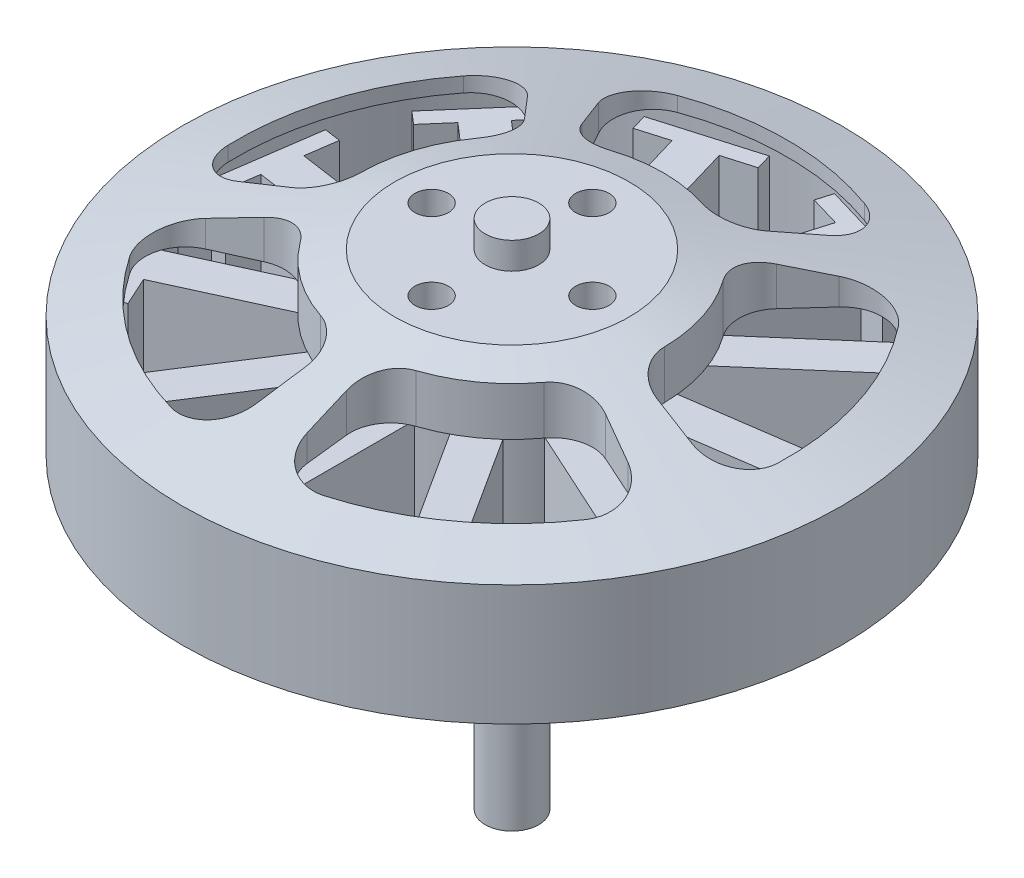
from build123d import *

# Parameters (mm, degrees)
CROQUIS1_R              = 24.6
SALIENTE_EXTRUIR1_DEPTH = 9
CROQUIS4_R              = 22.838904737
CORTAR_EXTRUIR1_DEPTH   = 9
CORTAR_EXTRUIR2_DEPTH   = 38.245268156
SALIENTE_EXTRUIR2_START = -6
CROQUIS3_R              = 2
SALIENTE_EXTRUIR2_DEPTH = 8
SALIENTE_EXTRUIR3_DEPTH = 8
CROQUIS7_R              = 7.5
SALIENTE_EXTRUIR4_DEPTH = 5
CROQUIS8_R              = 12.25
SALIENTE_EXTRUIR5_DEPTH = 1.2
SALIENTE_EXTRUIR6_START = 16
CROQUIS9_R              = 2
SALIENTE_EXTRUIR6_DEPTH = 16
SALIENTE_EXTRUIR7_DEPTH = 0.8
CROQUIS11_R             = 1.25
CORTAR_EXTRUIR3_DEPTH   = 3
CROQUIS12_R             = 1.348388042
CORTAR_EXTRUIR4_DEPTH   = 6
SALIENTE_EXTRUIR8_START = 1
SALIENTE_EXTRUIR8_DEPTH = 2


with BuildPart() as part:
    # Croquis1 → Saliente-Extruir1 (new body)
    with BuildSketch(Plane(origin=(0, 0, 0), x_dir=(1, 0, 0), z_dir=(0, 1, 0))):
        with Locations(Location((0, 0, 0), (0, 0, 270))):
            Circle(CROQUIS1_R)
    extrude(amount=SALIENTE_EXTRUIR1_DEPTH)

    # Croquis2 → Revolución1 (revolve)
    with BuildSketch(Plane.XY, mode=Mode.PRIVATE) as revoluci_n1_sk:
        Polygon((-24.6, 9), (-8.75, 13.3), (0, 13.3), (0, 9), align=None)
    revolve(revoluci_n1_sk.sketch.rotate(Axis((0, 13.3, 0), (0, -1, 0)), 270), axis=Axis((0, 13.3, 0), (0, -1, 0)))

    # Croquis4 → Cortar-Extruir1 (cut)
    with BuildSketch(Plane.XZ):
        with Locations(Location((0, 0, 0), (0, 0, 270))):
            Circle(CROQUIS4_R)
    extrude(amount=-CORTAR_EXTRUIR1_DEPTH, mode=Mode.SUBTRACT)

    # Croquis5 → Cortar-Extruir2 (cut, through all)
    with BuildSketch(Plane(origin=(0, 13.3, 0), x_dir=(1, 0, 0), z_dir=(0, 1, 0))):
        with BuildLine():
            Line((-8.570425655, 15.0190469), (-6.930143541, 12.144571933))
            ThreePointArc((-6.930143541, 12.144571933), (-5.416422682, 10.837196574), (-3.417344005, 10.7718849))
            ThreePointArc((-3.417344005, 10.7718849), (0, 11.300962098), (3.417344005, 10.7718849))
            ThreePointArc((3.417344005, 10.7718849), (5.416422682, 10.837196574), (6.930143541, 12.144571933))
            Line((6.930143541, 12.144571933), (8.570425655, 15.0190469))
            ThreePointArc((8.570425655, 15.0190469), (8.780099609, 17.542313757), (6.984398181, 19.327333417))
            ThreePointArc((6.984398181, 19.327333417), (0, 20.550611547), (-6.984398181, 19.327333417))
            ThreePointArc((-6.984398181, 19.327333417), (-8.780099609, 17.542313757), (-8.570425655, 15.0190469))
        make_face()
        with BuildLine():
            Line((11.635555246, 12.792099897), (9.408642147, 10.34383729))
            ThreePointArc((9.408642147, 10.34383729), (8.633019762, 8.500201999), (9.188653954, 6.57878278))
            ThreePointArc((9.188653954, 6.57878278), (10.747853644, 3.492189341), (11.3006887, 0.078608211))
            ThreePointArc((11.3006887, 0.078608211), (11.980553077, -1.802446174), (13.691706402, -2.838079057))
            Line((13.691706402, -2.838079057), (16.932369599, -3.509818435))
            ThreePointArc((16.932369599, -3.509818435), (19.396931801, -2.929497875), (20.539684122, -0.670082921))
            ThreePointArc((20.539684122, -0.670082921), (19.544793026, 6.350488213), (16.223088655, 12.615031884))
            ThreePointArc((16.223088655, 12.615031884), (13.970531818, 13.771244019), (11.635555246, 12.792099897))
        make_face()
        with BuildLine():
            Line((15.761594275, -7.113094375), (12.745004176, -5.751728914))
            ThreePointArc((12.745004176, -5.751728914), (10.751922321, -5.583782827), (9.096244459, -6.705973537))
            ThreePointArc((9.096244459, -6.705973537), (6.642538858, -9.14267039), (3.566865708, -10.723302354))
            ThreePointArc((3.566865708, -10.723302354), (1.987966324, -11.951169572), (1.53179638, -13.898601253))
            Line((1.53179638, -13.898601253), (1.894354267, -17.188233987))
            ThreePointArc((1.894354267, -17.188233987), (3.207863522, -19.352843014), (5.709824725, -19.741467437))
            ThreePointArc((5.709824725, -19.741467437), (12.079346393, -16.625793986), (17.010818372, -11.530814943))
            ThreePointArc((17.010818372, -11.530814943), (17.414363114, -9.031216887), (15.761594275, -7.113094375))
        make_face()
        with BuildLine():
            Line((-1.894354267, -17.188233987), (-1.53179638, -13.898601253))
            ThreePointArc((-1.53179638, -13.898601253), (-1.987966324, -11.951169572), (-3.566865708, -10.723302354))
            ThreePointArc((-3.566865708, -10.723302354), (-6.642538858, -9.14267039), (-9.096244459, -6.705973537))
            ThreePointArc((-9.096244459, -6.705973537), (-10.751922321, -5.583782827), (-12.745004176, -5.751728914))
            Line((-12.745004176, -5.751728914), (-15.761594275, -7.113094375))
            ThreePointArc((-15.761594275, -7.113094375), (-17.414363114, -9.031216887), (-17.010818372, -11.530814943))
            ThreePointArc((-17.010818372, -11.530814943), (-12.079346393, -16.625793986), (-5.709824725, -19.741467437))
            ThreePointArc((-5.709824725, -19.741467437), (-3.207863522, -19.352843014), (-1.894354267, -17.188233987))
        make_face()
        with BuildLine():
            Line((-16.932369599, -3.509818435), (-13.691706402, -2.838079057))
            ThreePointArc((-13.691706402, -2.838079057), (-11.980553077, -1.802446174), (-11.3006887, 0.078608211))
            ThreePointArc((-11.3006887, 0.078608211), (-10.747853644, 3.492189341), (-9.188653954, 6.57878278))
            ThreePointArc((-9.188653954, 6.57878278), (-8.633019762, 8.500201999), (-9.408642147, 10.34383729))
            Line((-9.408642147, 10.34383729), (-11.635555246, 12.792099897))
            ThreePointArc((-11.635555246, 12.792099897), (-13.970531818, 13.771244019), (-16.223088655, 12.615031884))
            ThreePointArc((-16.223088655, 12.615031884), (-19.544793026, 6.350488213), (-20.539684122, -0.670082921))
            ThreePointArc((-20.539684122, -0.670082921), (-19.396931801, -2.929497875), (-16.932369599, -3.509818435))
        make_face()
    extrude(amount=-CORTAR_EXTRUIR2_DEPTH, mode=Mode.SUBTRACT)

    # Croquis3 → Saliente-Extruir2 (add)
    with BuildSketch(Plane(origin=(0, 13.3, 0), x_dir=(1, 0, 0), z_dir=(0, 1, 0)).offset(SALIENTE_EXTRUIR2_START)):
        with Locations(Location((0, 0, 0), (0, 0, 90))):
            Circle(CROQUIS3_R)
    extrude(amount=SALIENTE_EXTRUIR2_DEPTH)

    # Croquis6 → Saliente-Extruir3 (add)
    with BuildSketch(Plane.XZ.offset(-7.3)):
        with BuildLine():
            Line((-1.41776314, 20.230911324), (-1.41776314, 8.691927398))
            ThreePointArc((-1.41776314, 8.691927398), (-2.48116113, 8.450058797), (-3.506512483, 8.078615254))
            Line((-3.506512483, 8.078615254), (-9.744958186, 17.785826247))
            Line((-9.744958186, 17.785826247), (-7.771261406, 19.054244148))
            Line((-7.771261406, 19.054244148), (-8.431305766, 20.08129322))
            Line((-8.431305766, 20.08129322), (-14.764095827, 16.011456172))
            Line((-14.764095827, 16.011456172), (-14.104051466, 14.984407099))
            Line((-14.104051466, 14.984407099), (-12.130354686, 16.252825001))
            Line((-12.130354686, 16.252825001), (-5.891908984, 6.545614008))
            ThreePointArc((-5.891908984, 6.545614008), (-6.655732261, 5.767224834), (-7.317495169, 4.900399847))
            Line((-7.317495169, 4.900399847), (-17.813724142, 9.693867005))
            Line((-17.813724142, 9.693867005), (-16.839103244, 11.827989086))
            Line((-16.839103244, 11.827989086), (-17.949632544, 12.335150824))
            Line((-17.949632544, 12.335150824), (-21.076794527, 5.487621234))
            Line((-21.076794527, 5.487621234), (-19.966265227, 4.980459496))
            Line((-19.966265227, 4.980459496), (-18.991644329, 7.114581576))
            Line((-18.991644329, 7.114581576), (-8.495415356, 2.321114419))
            ThreePointArc((-8.495415356, 2.321114419), (-8.717155427, 1.253337736), (-8.805224842, 0.166342114))
            Line((-8.805224842, 0.166342114), (-20.226758549, -1.475826517))
            Line((-20.226758549, -1.475826517), (-20.560648782, 0.846431062))
            Line((-20.560648782, 0.846431062), (-21.769077816, 0.672685197))
            Line((-21.769077816, 0.672685197), (-20.697759886, -6.778494673))
            Line((-20.697759886, -6.778494673), (-19.489330852, -6.604748808))
            Line((-19.489330852, -6.604748808), (-19.823221085, -4.282491229))
            Line((-19.823221085, -4.282491229), (-8.401687378, -2.640322598))
            ThreePointArc((-8.401687378, -2.640322598), (-8.010943337, -3.658475238), (-7.497357842, -4.620528066))
            Line((-7.497357842, -4.620528066), (-16.217940032, -12.176955548))
            Line((-16.217940032, -12.176955548), (-17.754333606, -10.403862844))
            Line((-17.754333606, -10.403862844), (-18.676994694, -11.203353227))
            Line((-18.676994694, -11.203353227), (-13.747332725, -16.892486415))
            Line((-13.747332725, -16.892486415), (-12.824671637, -16.092996032))
            Line((-12.824671637, -16.092996032), (-14.361065211, -14.319903328))
            Line((-14.361065211, -14.319903328), (-5.640483021, -6.763475845))
            ThreePointArc((-5.640483021, -6.763475845), (-4.761313341, -7.408748173), (-3.809132701, -7.940413231))
            Line((-3.809132701, -7.940413231), (-7.060040146, -19.011987231))
            Line((-7.060040146, -19.011987231), (-9.311142957, -18.351003807))
            Line((-9.311142957, -18.351003807), (-9.655097722, -19.522406161))
            Line((-9.655097722, -19.522406161), (-2.432224557, -21.643233077))
            Line((-2.432224557, -21.643233077), (-2.088269792, -20.471830723))
            Line((-2.088269792, -20.471830723), (-4.339372603, -19.8108473))
            Line((-4.339372603, -19.8108473), (-1.088465159, -8.7392733))
            ThreePointArc((-1.088465159, -8.7392733), (0, -8.806795911), (1.088465159, -8.7392733))
            Line((1.088465159, -8.7392733), (4.339372603, -19.8108473))
            Line((4.339372603, -19.8108473), (2.088269792, -20.471830723))
            Line((2.088269792, -20.471830723), (2.432224557, -21.643233077))
            Line((2.432224557, -21.643233077), (9.655097722, -19.522406161))
            Line((9.655097722, -19.522406161), (9.311142957, -18.351003807))
            Line((9.311142957, -18.351003807), (7.060040146, -19.011987231))
            Line((7.060040146, -19.011987231), (3.809132701, -7.940413231))
            ThreePointArc((3.809132701, -7.940413231), (4.761313341, -7.408748173), (5.640483021, -6.763475845))
            Line((5.640483021, -6.763475845), (14.361065211, -14.319903328))
            Line((14.361065211, -14.319903328), (12.824671637, -16.092996032))
            Line((12.824671637, -16.092996032), (13.747332725, -16.892486415))
            Line((13.747332725, -16.892486415), (18.676994694, -11.203353227))
            Line((18.676994694, -11.203353227), (17.754333606, -10.403862844))
            Line((17.754333606, -10.403862844), (16.217940032, -12.176955548))
            Line((16.217940032, -12.176955548), (7.497357842, -4.620528066))
            ThreePointArc((7.497357842, -4.620528066), (8.010943337, -3.658475238), (8.401687378, -2.640322598))
            Line((8.401687378, -2.640322598), (19.823221085, -4.282491229))
            Line((19.823221085, -4.282491229), (19.489330852, -6.604748808))
            Line((19.489330852, -6.604748808), (20.697759886, -6.778494673))
            Line((20.697759886, -6.778494673), (21.769077816, 0.672685197))
            Line((21.769077816, 0.672685197), (20.560648782, 0.846431062))
            Line((20.560648782, 0.846431062), (20.226758549, -1.475826517))
            Line((20.226758549, -1.475826517), (8.805224842, 0.166342114))
            ThreePointArc((8.805224842, 0.166342114), (8.717155427, 1.253337736), (8.495415356, 2.321114419))
            Line((8.495415356, 2.321114419), (18.991644329, 7.114581576))
            Line((18.991644329, 7.114581576), (19.966265227, 4.980459496))
            Line((19.966265227, 4.980459496), (21.076794527, 5.487621234))
            Line((21.076794527, 5.487621234), (17.949632544, 12.335150824))
            Line((17.949632544, 12.335150824), (16.839103244, 11.827989086))
            Line((16.839103244, 11.827989086), (17.813724142, 9.693867005))
            Line((17.813724142, 9.693867005), (7.317495169, 4.900399847))
            ThreePointArc((7.317495169, 4.900399847), (6.655732261, 5.767224834), (5.891908984, 6.545614008))
            Line((5.891908984, 6.545614008), (12.130354686, 16.252825001))
            Line((12.130354686, 16.252825001), (14.104051466, 14.984407099))
            Line((14.104051466, 14.984407099), (14.764095827, 16.011456172))
            Line((14.764095827, 16.011456172), (8.431305766, 20.08129322))
            Line((8.431305766, 20.08129322), (7.771261406, 19.054244148))
            Line((7.771261406, 19.054244148), (9.744958186, 17.785826247))
            Line((9.744958186, 17.785826247), (3.506512483, 8.078615254))
            ThreePointArc((3.506512483, 8.078615254), (2.48116113, 8.450058797), (1.41776314, 8.691927398))
            Line((1.41776314, 8.691927398), (1.41776314, 20.230911324))
            Line((1.41776314, 20.230911324), (3.76390102, 20.230911324))
            Line((3.76390102, 20.230911324), (3.76390102, 21.451766907))
            Line((3.76390102, 21.451766907), (-3.76390102, 21.451766907))
            Line((-3.76390102, 21.451766907), (-3.76390102, 20.230911324))
            Line((-3.76390102, 20.230911324), (-1.41776314, 20.230911324))
        make_face()
    extrude(amount=SALIENTE_EXTRUIR3_DEPTH)

    # Croquis7 → Saliente-Extruir4 (add)
    with BuildSketch(Plane.XZ.offset(0.7)):
        Circle(CROQUIS7_R)
    extrude(amount=SALIENTE_EXTRUIR4_DEPTH)

    # Croquis8 → Saliente-Extruir5 (add)
    with BuildSketch(Plane.XZ.offset(5.7)):
        Circle(CROQUIS8_R)
    extrude(amount=SALIENTE_EXTRUIR5_DEPTH)

    # Croquis9 → Saliente-Extruir6 (add)
    with BuildSketch(Plane.XZ.offset(6.9).offset(SALIENTE_EXTRUIR6_START)):
        Circle(CROQUIS9_R)
    extrude(amount=-SALIENTE_EXTRUIR6_DEPTH)

    # Croquis10 → Saliente-Extruir7 (add)
    with BuildSketch(Plane.XZ.offset(6.9)):
        with BuildLine():
            Line((-1.85, 4.270295341), (-1.85, 1.681517172))
            ThreePointArc((-1.85, 1.681517172), (0, -2.5), (1.85, 1.681517172))
            Line((1.85, 1.681517172), (1.85, 4.270295341))
            Line((1.85, 4.270295341), (-1.85, 4.270295341))
        make_face()
    extrude(amount=SALIENTE_EXTRUIR7_DEPTH)

    # Croquis11 → Cortar-Extruir3 (cut)
    with BuildSketch(Plane(origin=(0, 13.3, 0), x_dir=(1, 0, 0), z_dir=(0, 1, 0))):
        with Locations(Location((0, -6, 0), (0, 0, 180))):
            Circle(CROQUIS11_R)
        with Locations(Location((6, 0, 0), (0, 0, 180))):
            Circle(CROQUIS11_R)
        with Locations(Location((0, 6, 0), (0, 0, 180))):
            Circle(CROQUIS11_R)
        with Locations(Location((-6, 0, 0), (0, 0, 180))):
            Circle(CROQUIS11_R)
    extrude(amount=-CORTAR_EXTRUIR3_DEPTH, mode=Mode.SUBTRACT)

    # Croquis12 → Cortar-Extruir4 (cut)
    with BuildSketch(Plane.XZ.offset(6.9)):
        with Locations((0, 8)):
            Circle(CROQUIS12_R)
        with Locations((0, -8)):
            Circle(CROQUIS12_R)
        with Locations((-9.5, 0)):
            Circle(CROQUIS12_R)
        with Locations((9.5, 0)):
            Circle(CROQUIS12_R)
    extrude(amount=-CORTAR_EXTRUIR4_DEPTH, mode=Mode.SUBTRACT)

    # Croquis13 → Saliente-Extruir8 (add)
    with BuildSketch(Plane(origin=(0, -5.7, 0), x_dir=(1, 0, 0), z_dir=(0, 1, 0)).offset(SALIENTE_EXTRUIR8_START)):
        Polygon((-6.908867887, 2.747843539), (-3.184587628, 6.472123798), (-16.034776003, 19.322312173), (-19.759056262, 15.598031914), align=None)
    extrude(amount=SALIENTE_EXTRUIR8_DEPTH)


solid = part.part
